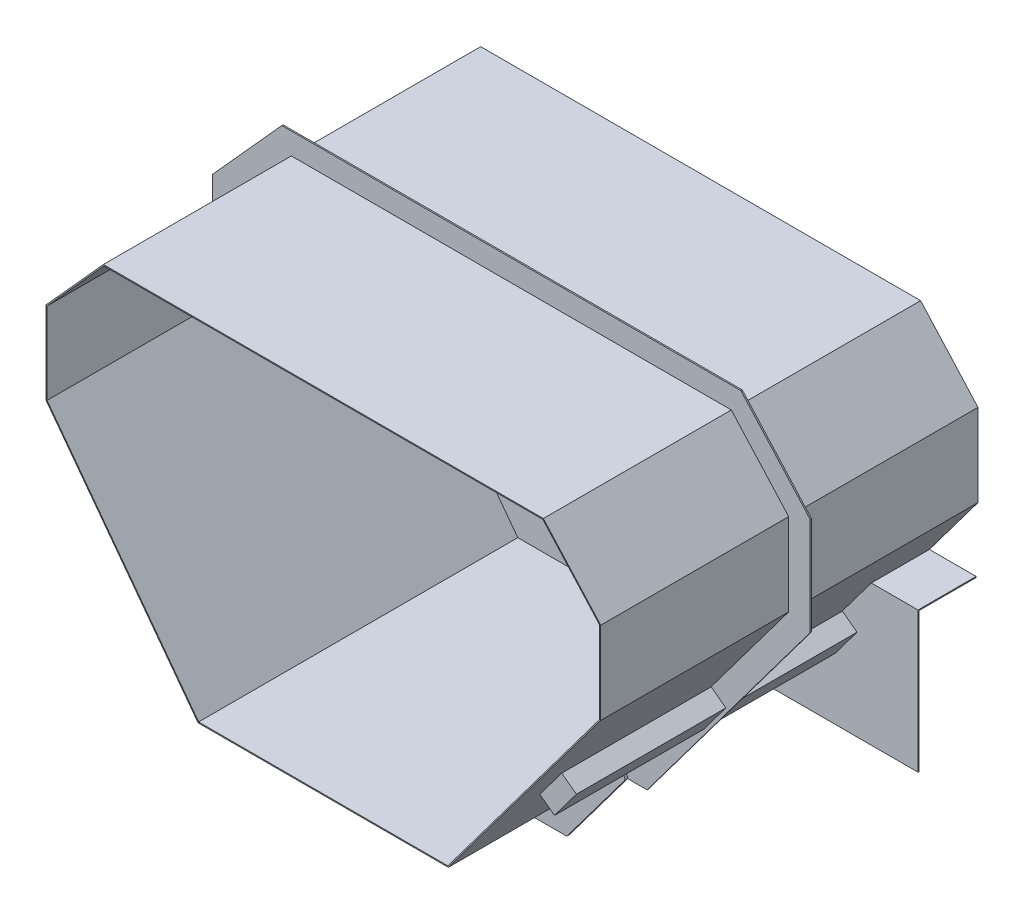
from build123d import *

# Parameters (mm, degrees)
BOSS_EXTRUDE1_DEPTH  = 1445
BOSS_EXTRUDE2_DEPTH  = 5
SKETCH4_W            = 20
SKETCH4_H            = 150
BOSS_EXTRUDE4_DEPTH  = 1145
BOSS_EXTRUDE9_START  = 600
BOSS_EXTRUDE9_DEPTH  = 20
CUT_EXTRUDE1_START   = -1874
SKETCH6_W            = 3505.832056238
SKETCH6_H            = 1215.707549371
CUT_EXTRUDE1_DEPTH   = 1075.262189
BOSS_EXTRUDE11_DEPTH = 2110
SKETCH8_W            = 210
SKETCH8_H            = 270
SKETCH8_W_2          = 110
SKETCH8_H_2          = 170
SKETCH8_W_3          = 460
SKETCH8_W_4          = 360
SKETCH8_H_3          = 110
BOSS_EXTRUDE12_DEPTH = 5


with BuildPart() as part:
    # Sketch1 → Boss-Extrude1 (new, symmetric)
    with BuildSketch(Plane.XY):
        Polygon((-1685, 804), (1685, 804), (2124.5, 316), (2124.5, -316), (957.5, -1874), (-959.5, -1874), (-2124.5, -316), (-2124.5, 316), align=None)
        Polygon((-1681.438728184, 796), (-2116.5, 312.928553706), (-2116.5, -313.339728652), (-955.49280095, -1866), (953.496917228, -1866), (2116.5, -313.336072871), (2116.5, 312.928553706), (1681.438728184, 796), align=None, mode=Mode.SUBTRACT)
    extrude(amount=BOSS_EXTRUDE1_DEPTH, both=True)

    # Sketch1<4> → Boss-Extrude2 (add, symmetric)
    with BuildSketch(Plane.XY):
        Polygon((1758.451231204, 969), (-1758.451231204, 969), (-2289.5, 379.348579813), (-2289.5, -370.868096546), (-1042.148480408, -2039), (1040.063582176, -2039), (2289.5, -370.943497026), (2289.5, 379.348579813), align=None)
        Polygon((-2124.5, 316), (-1685, 804), (1685, 804), (2124.5, 316), (2124.5, -316), (957.5, -1874), (-959.5, -1874), (-1363.127826452, -1334.21274368), (-1475.248610905, -1418.051456061), (-1642.926035666, -1193.809887154), (-1530.805251212, -1109.971174774), (-2124.5, -316), align=None, mode=Mode.SUBTRACT)
    extrude(amount=BOSS_EXTRUDE2_DEPTH, both=True)

    # Sketch4 → Boss-Extrude4 (add, symmetric)
    with BuildSketch(Plane.XY.offset(5)):
        Polygon((-1642.926035666, -1193.809887154), (-1475.248610905, -1418.051456061), (-1363.127826452, -1334.21274368), (-1530.805251212, -1109.971174774), align=None)
        Polygon((1475.248610905, -1418.051456061), (1363.127826452, -1334.21274368), (1530.805251212, -1109.971174774), (1642.926035666, -1193.809887154), align=None)
        with Locations((0, -1949.133011303)):
            Rectangle(SKETCH4_W, SKETCH4_H)
    extrude(amount=BOSS_EXTRUDE4_DEPTH, both=True)

    # Sketch5 → Boss-Extrude9 (add)
    with BuildSketch(Plane.XY.offset(BOSS_EXTRUDE9_START)):
        with BuildLine():
            Line((-1363.127826452, -1334.21274368), (-1475.248610905, -1418.051456061))
            ThreePointArc((-1475.248610905, -1418.051456061), (-1485.021035311, -1434.501873829), (-1480.298980919, -1453.044223352))
            Line((-1480.298980919, -1453.044223352), (-1042.148480408, -2039))
            Line((-1042.148480408, -2039), (1040.063582176, -2039))
            Line((1040.063582176, -2039), (1479.432400385, -1452.421920505))
            ThreePointArc((1479.432400385, -1452.421920505), (1484.168247474, -1433.873281887), (1474.394355934, -1417.41268389))
            Line((1474.394355934, -1417.41268389), (1363.127826452, -1334.21274368))
            Line((1363.127826452, -1334.21274368), (957.5, -1874))
            Line((957.5, -1874), (-959.5, -1874))
            Line((-959.5, -1874), (-1363.127826452, -1334.21274368))
        make_face()
    extrude(amount=BOSS_EXTRUDE9_DEPTH)

    # Sketch6 → Cut-Extrude1 (cut)
    with BuildSketch(Plane(origin=(0, 0, 0), x_dir=(1, 0, 0), z_dir=(0, 1, 0)).offset(CUT_EXTRUDE1_START)):
        with Locations((0, 1607.853774685)):
            Rectangle(SKETCH6_W, SKETCH6_H)
    extrude(amount=CUT_EXTRUDE1_DEPTH, mode=Mode.SUBTRACT)

    # Sketch8 → Boss-Extrude12 (add)
    # profile 1 of 4: a face of its own
    with BuildSketch(Plane(origin=(-1646.308604184, -1231.033070522, 0), x_dir=(0, 0, 1), z_dir=(-0.8008627460957028, -0.5988479455722043, 0))):
        with Locations((25, -641.621893436)):
            Rectangle(SKETCH8_W, SKETCH8_H)
        with Locations((27.803968445, -650.044864995)):
            Rectangle(SKETCH8_W_2, SKETCH8_H_2, mode=Mode.SUBTRACT)
    # profile 2 of 4: a face of its own
    with BuildSketch(Plane(origin=(-1646.308604184, -1231.033070522, 0), x_dir=(0, 0, 1), z_dir=(-0.8008627460957028, -0.5988479455722043, 0))):
        with Locations((285, -641.621893436)):
            Rectangle(SKETCH8_W, SKETCH8_H)
        with Locations((285, -641.621893436)):
            Rectangle(SKETCH8_W_2, SKETCH8_H_2, mode=Mode.SUBTRACT)
    # profile 3 of 4: a face of its own
    with BuildSketch(Plane(origin=(-1646.308604184, -1231.033070522, 0), x_dir=(0, 0, 1), z_dir=(-0.8008627460957028, -0.5988479455722043, 0))):
        with Locations((-235, -641.621893436)):
            Rectangle(SKETCH8_W, SKETCH8_H)
        with Locations((-235.303383431, -650.044864995)):
            Rectangle(SKETCH8_W_2, SKETCH8_H_2, mode=Mode.SUBTRACT)
    # profile 4 of 4: a face of its own
    with BuildSketch(Plane(origin=(-1646.308604184, -1231.033070522, 0), x_dir=(0, 0, 1), z_dir=(-0.8008627460957028, -0.5988479455722043, 0))):
        with Locations((-620, -641.621893436)):
            Rectangle(SKETCH8_W_3, SKETCH8_H)
        with Locations((-607.35413734, -620.044864995)):
            Rectangle(SKETCH8_W_4, SKETCH8_H_3, mode=Mode.SUBTRACT)
    extrude(amount=BOSS_EXTRUDE12_DEPTH)


with BuildPart() as body_2:
    # Sketch7 → Boss-Extrude11 (new, symmetric)
    with BuildSketch(Plane(origin=(0, 0, 0), x_dir=(0, 0, -1), z_dir=(1, 0, 0))):
        Polygon((1000, -812.933758103), (1000, -1889.031457311), (1008, -1889.031457311), (1008, -820.933758103), (1445.070039038, -820.933758103), (1445.070039038, -812.933758103), align=None)
    extrude(amount=BOSS_EXTRUDE11_DEPTH, both=True)


with BuildPart() as boss_extrude12_piece_1:
    # of the separate pieces the step leaves, piece 1, a body of its own (boss_extrude12_pieces)
    add(part.part.solids().sort_by_distance((-1685, 804, -1445))[0])


with BuildPart() as boss_extrude12_piece_2:
    # of the separate pieces the step leaves, piece 2, a body of its own (boss_extrude12_pieces)
    add(part.part.solids().sort_by_distance((-1342.919124117, -1636.767671332, -390))[0])


with BuildPart() as boss_extrude12_piece_3:
    # of the separate pieces the step leaves, piece 3, a body of its own (boss_extrude12_pieces)
    add(part.part.solids().sort_by_distance((-1342.919124117, -1636.767671332, 180))[0])


with BuildPart() as boss_extrude12_piece_4:
    # of the separate pieces the step leaves, piece 4, a body of its own (boss_extrude12_pieces)
    add(part.part.solids().sort_by_distance((-1342.919124117, -1636.767671332, -130))[0])


solid = Compound([body_2.part, boss_extrude12_piece_1.part, boss_extrude12_piece_2.part, boss_extrude12_piece_3.part, boss_extrude12_piece_4.part])
